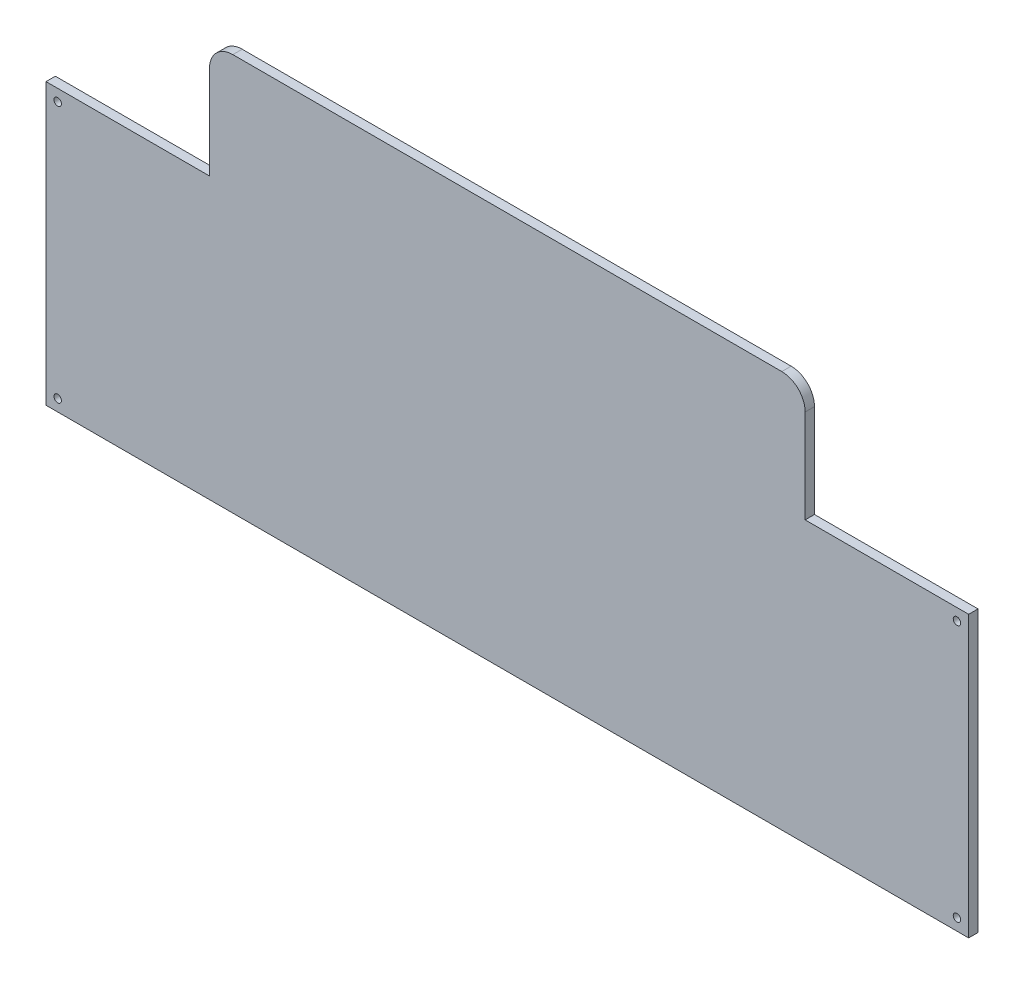
from build123d import *

# Parameters (mm, degrees)
SKETCH_1_R      = 1.6
EXTRUDE_1_DEPTH = 4


with BuildPart() as part:
    # 草图1 → 凸台-拉伸1 (new body)
    with BuildSketch(Plane.XY):
        with BuildLine():
            Line((-197.5, 60), (-127.5, 60))
            Line((-127.5, 60), (-127.5, 100))
            ThreePointArc((-127.5, 100), (-124.571067812, 107.071067812), (-117.5, 110))
            Line((-117.5, 110), (117.5, 110))
            ThreePointArc((117.5, 110), (124.571067812, 107.071067812), (127.5, 100))
            Line((127.5, 100), (127.5, 60))
            Line((127.5, 60), (197.5, 60))
            Line((197.5, 60), (197.5, -60))
            Line((197.5, -60), (-197.5, -60))
            Line((-197.5, -60), (-197.5, 60))
        make_face()
        with Locations((-192.5, 55)):
            Circle(SKETCH_1_R, mode=Mode.SUBTRACT)
        with Locations(Location((192.5, 55, 0), (0, 0, 180))):
            Circle(SKETCH_1_R, mode=Mode.SUBTRACT)
        with Locations((192.5, -55)):
            Circle(SKETCH_1_R, mode=Mode.SUBTRACT)
        with Locations(Location((-192.5, -55, 0), (0, 0, 180))):
            Circle(SKETCH_1_R, mode=Mode.SUBTRACT)
    extrude(amount=EXTRUDE_1_DEPTH)


solid = part.part
